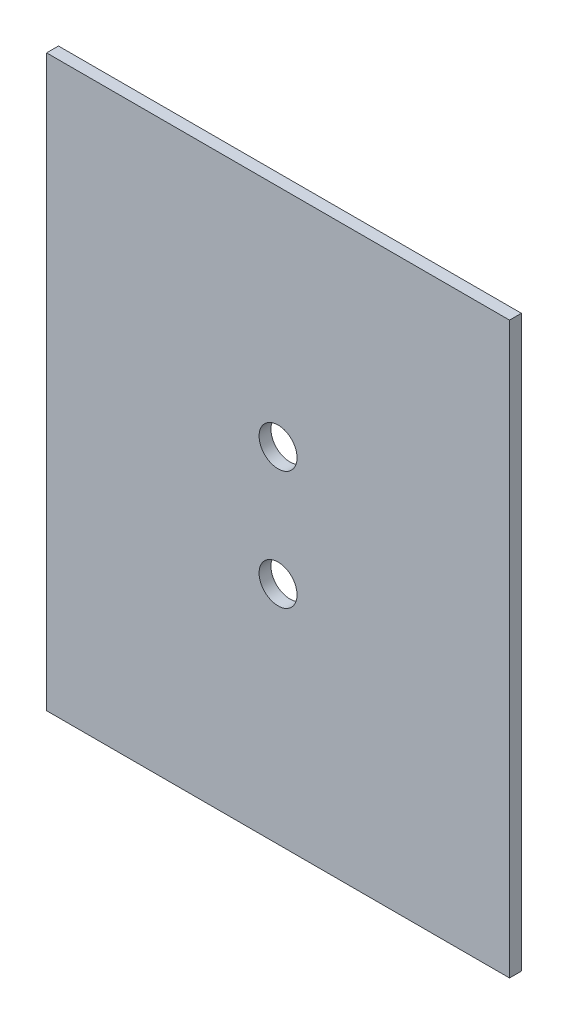
from build123d import *

# Parameters (mm, degrees)
SKETCH1_W           = 195
SKETCH1_H           = 240
SKETCH1_R           = 8
BOSS_EXTRUDE1_DEPTH = 5


with BuildPart() as part:
    # Sketch1 → Boss-Extrude1 (new body)
    with BuildSketch(Plane.XY):
        Rectangle(SKETCH1_W, SKETCH1_H)
        with Locations((0, 25)):
            Circle(SKETCH1_R, mode=Mode.SUBTRACT)
        with Locations((0, -25)):
            Circle(SKETCH1_R, mode=Mode.SUBTRACT)
    extrude(amount=BOSS_EXTRUDE1_DEPTH)


solid = part.part
